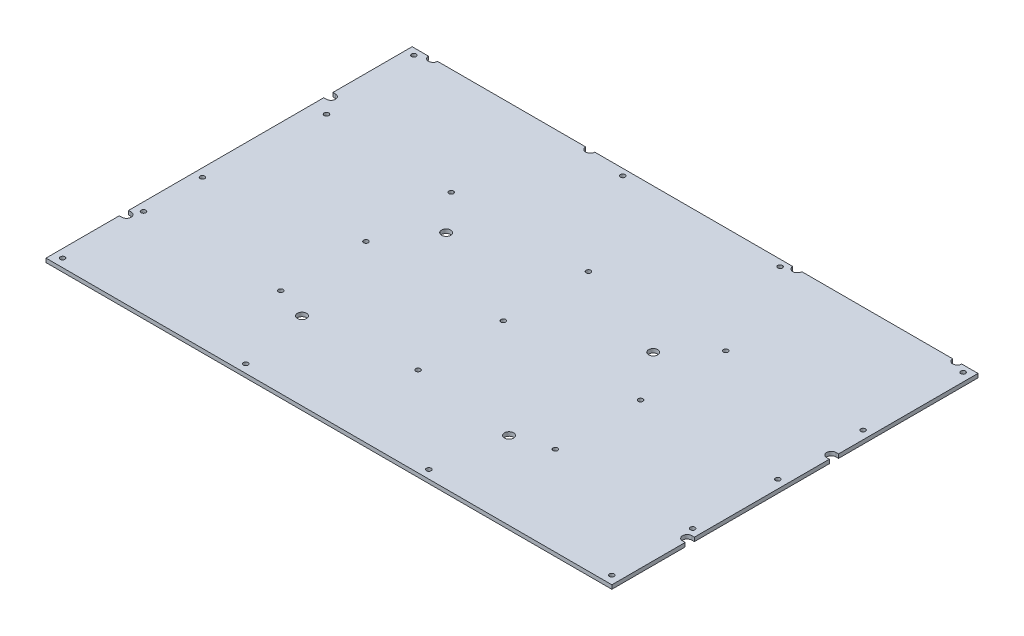
from build123d import *

# Parameters (mm, degrees)
SKETCH1_W            = 431.8
SKETCH1_H            = 294.7
BOSS_EXTRUDE1_DEPTH  = 3
SKETCH2_R            = 1.775
CUT_EXTRUDE1_DEPTH   = 262.407407125
LPATTERN1_COUNT      = 4
LPATTERN1_PITCH      = 139.7
SKETCH3_R            = 1.775
CUT_EXTRUDE2_DEPTH   = 262.407407125
LPATTERN2_COUNT      = 5
LPATTERN2_PITCH      = 104.77
LPATTERN2_COUNT_DIR2 = 3
LPATTERN2_PITCH_DIR2 = 65
SKETCH4_R            = 1.775
CUT_EXTRUDE3_DEPTH   = 10
SKETCH7_R            = 3.5
CUT_EXTRUDE5_DEPTH   = 262.407407125
SKETCH8_W            = 2
SKETCH8_H            = 7
CUT_EXTRUDE6_DEPTH   = 262.407407125
SKETCH9_W            = 431.8
SKETCH9_H            = 15.3
CUT_EXTRUDE7_DEPTH   = 262.407407125
SKETCH11_R           = 1.775
BOSS_EXTRUDE3_DEPTH  = 3
SKETCH12_R           = 1.775
CUT_EXTRUDE8_DEPTH   = 262.407407125


with BuildPart() as part:
    # Sketch1 → Boss-Extrude1 (new body)
    with BuildSketch(Plane(origin=(0, 0, 0), x_dir=(1, 0, 0), z_dir=(0, 1, 0))):
        Rectangle(SKETCH1_W, SKETCH1_H)
    extrude(amount=BOSS_EXTRUDE1_DEPTH)

    # Sketch2 → Cut-Extrude1 (cut, through all)
    with BuildSketch(Plane(origin=(0, 3, 0), x_dir=(1, 0, 0), z_dir=(0, 1, 0))):
        with Locations(Location((-209.55, -125.7, 0), (0, 0, 270))):
            Circle(SKETCH2_R)
        with Locations(Location((-209.55, 142.35, 0), (0, 0, 270))):
            Circle(SKETCH2_R)
    cut_extrude1 = extrude(amount=-CUT_EXTRUDE1_DEPTH, mode=Mode.SUBTRACT)

    # LPattern1: Cut-Extrude1 ×4
    with Locations(*[(i * LPATTERN1_PITCH, 0, 0) for i in range(1, LPATTERN1_COUNT)]):
        add(cut_extrude1, mode=Mode.SUBTRACT)

    # Sketch3 → Cut-Extrude2 (cut, through all)
    with BuildSketch(Plane(origin=(0, 3, 0), x_dir=(1, 0, 0), z_dir=(0, 1, 0))):
        with Locations(Location((-209.55, -64, 0), (0, 0, 270))):
            Circle(SKETCH3_R)
    cut_extrude2 = extrude(amount=-CUT_EXTRUDE2_DEPTH, mode=Mode.SUBTRACT)

    # LPattern2: Cut-Extrude2 5 × 3, 2 skipped
    with Locations(*[(i * LPATTERN2_PITCH, 0, -j * LPATTERN2_PITCH_DIR2) for i in range(LPATTERN2_COUNT) for j in range(LPATTERN2_COUNT_DIR2) if (i, j) not in ((0, 0), (0, 1), (0, 2))]):
        add(cut_extrude2, mode=Mode.SUBTRACT)

    # Sketch4 → Cut-Extrude3 (cut)
    with BuildSketch(Plane(origin=(0, 3, 0), x_dir=(1, 0, 0), z_dir=(0, 1, 0))):
        with Locations(Location((-203.9, 70, 0), (0, 0, 270))):
            Circle(SKETCH4_R)
        with Locations(Location((-209.55, -19, 0), (0, 0, 270))):
            Circle(SKETCH4_R)
    extrude(amount=-CUT_EXTRUDE3_DEPTH, mode=Mode.SUBTRACT)

    # Sketch7 → Cut-Extrude5 (cut, through all)
    with BuildSketch(Plane.XZ):
        with Locations((-213.9, -83.38)):
            Circle(SKETCH7_R)
        with Locations((-213.9, 72.58)):
            Circle(SKETCH7_R)
        with Locations((213.9, 72.58)):
            Circle(SKETCH7_R)
        with Locations((213.9, -37.42)):
            Circle(SKETCH7_R)
        with Locations((200, -147.42)):
            Circle(SKETCH7_R)
        with Locations((78, -147.42)):
            Circle(SKETCH7_R)
        with Locations((-80, -147.42)):
            Circle(SKETCH7_R)
        with Locations(Location((-80, -37.42, 0), (0, 0, 270))):
            Circle(SKETCH7_R)
        with Locations(Location((78, -37.42, 0), (0, 0, 270))):
            Circle(SKETCH7_R)
        with Locations(Location((78, 72.58, 0), (0, 0, 270))):
            Circle(SKETCH7_R)
        with Locations(Location((-80, 72.58, 0), (0, 0, 270))):
            Circle(SKETCH7_R)
        with Locations((-200, -147.42)):
            Circle(SKETCH7_R)
    extrude(amount=-CUT_EXTRUDE5_DEPTH, mode=Mode.SUBTRACT)

    # Sketch8 → Cut-Extrude6 (cut, through all)
    with BuildSketch(Plane(origin=(0, 3, 0), x_dir=(1, 0, 0), z_dir=(0, 1, 0))):
        with Locations((214.9, 37.42)):
            Rectangle(SKETCH8_W, SKETCH8_H)
        with Locations((214.9, -72.58)):
            Rectangle(SKETCH8_W, SKETCH8_H)
        with Locations((-214.9, 83.38)):
            Rectangle(SKETCH8_W, SKETCH8_H)
        with Locations((-214.9, -72.58)):
            Rectangle(SKETCH8_W, SKETCH8_H)
    extrude(amount=-CUT_EXTRUDE6_DEPTH, mode=Mode.SUBTRACT)

    # Sketch9 → Cut-Extrude7 (cut, through all)
    with BuildSketch(Plane.XZ):
        with Locations((0, 139.7)):
            Rectangle(SKETCH9_W, SKETCH9_H)
    extrude(amount=-CUT_EXTRUDE7_DEPTH, mode=Mode.SUBTRACT)

    # Sketch11 → Boss-Extrude3 (add)
    with BuildSketch(Plane(origin=(0, 3, 0), x_dir=(1, 0, 0), z_dir=(0, 1, 0))):
        with Locations((-69.85, 142.35)):
            Circle(SKETCH11_R)
    extrude(amount=-BOSS_EXTRUDE3_DEPTH)

    # Sketch12 → Cut-Extrude8 (cut, through all)
    with BuildSketch(Plane(origin=(0, 3, 0), x_dir=(1, 0, 0), z_dir=(0, 1, 0))):
        with Locations(Location((-50.15, 142.35, 0), (0, 0, 270))):
            Circle(SKETCH12_R)
    extrude(amount=-CUT_EXTRUDE8_DEPTH, mode=Mode.SUBTRACT)


solid = part.part
